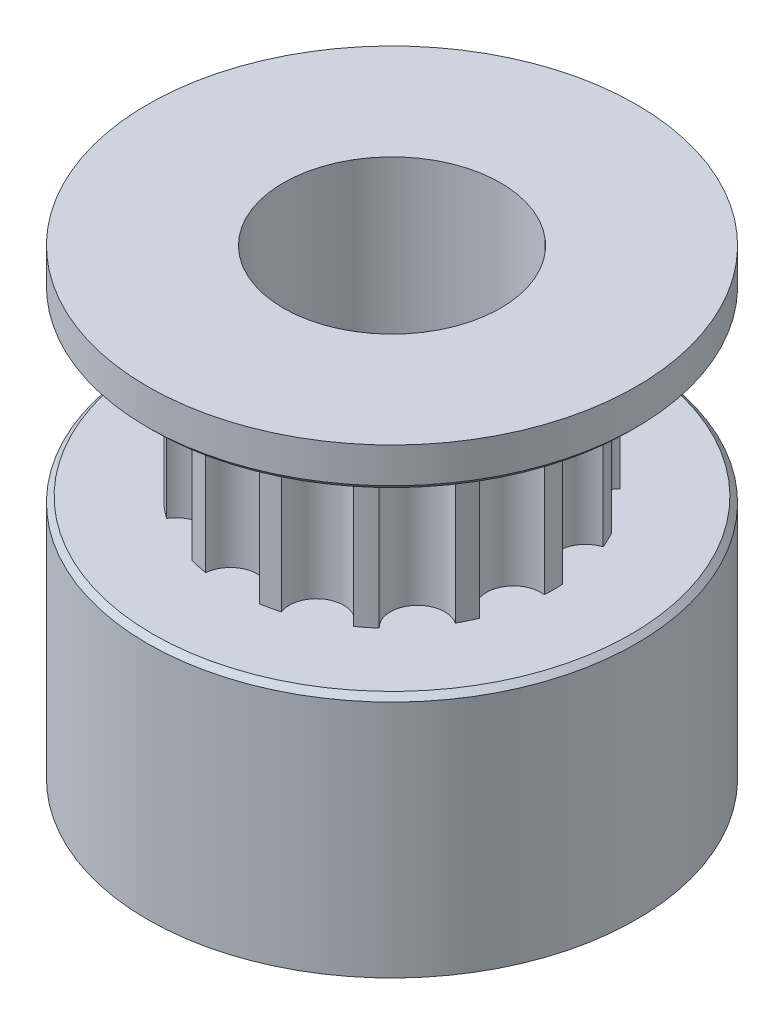
from build123d import *

# Parameters (mm, degrees)
SKETCH_2_R          = 9
EXTRUDE_1_DEPTH     = 9
EXTRUDE_2_DEPTH     = 6.5
SKETCH_4_R          = 9
EXTRUDE_3_DEPTH     = 1.5
SKETCH_5_R          = 4
CUT_EXTRUDE_1_DEPTH = 22.236760582
CHAMFER_1_SIZE      = 0.2


with BuildPart() as part:
    # 草图2 → 凸台-拉伸1 (new body)
    with BuildSketch(Plane(origin=(0, 0, 0), x_dir=(1, 0, 0), z_dir=(0, 1, 0))):
        with Locations(Location((0, 0, 0), (0, 0, 270))):
            Circle(SKETCH_2_R)
    extrude(amount=EXTRUDE_1_DEPTH)

    # 草图3 → 凸台-拉伸2 (add)
    with BuildSketch(Plane(origin=(0, 9, 0), x_dir=(1, 0, 0), z_dir=(0, 1, 0))):
        with BuildLine():
            ThreePointArc((-3.444184526, 4.855302323), (-3.711538364, 4.654121901), (-3.967166599, 4.438238037))
            ThreePointArc((-3.967166599, 4.438238037), (-3.872290418, 3.088048563), (-5.20973976, 2.880100577))
            ThreePointArc((-5.20973976, 2.880100577), (-5.363328331, 2.582842797), (-5.499972914, 2.277425222))
            ThreePointArc((-5.499972914, 2.277425222), (-4.828667171, 1.102111772), (-5.943442141, 0.334459589))
            ThreePointArc((-5.943442141, 0.334459589), (-5.952845345, 0), (-5.943442141, -0.334459589))
            ThreePointArc((-5.943442141, -0.334459589), (-4.828667171, -1.102111772), (-5.499972914, -2.277425222))
            ThreePointArc((-5.499972914, -2.277425222), (-5.363328331, -2.582842797), (-5.20973976, -2.880100577))
            ThreePointArc((-5.20973976, -2.880100577), (-3.872290418, -3.088048563), (-3.967166599, -4.438238037))
            ThreePointArc((-3.967166599, -4.438238037), (-3.711538364, -4.654121901), (-3.444184526, -4.855302323))
            ThreePointArc((-3.444184526, -4.855302323), (-2.148959057, -4.462359463), (-1.648614285, -5.720003377))
            ThreePointArc((-1.648614285, -5.720003377), (-1.324632706, -5.803595083), (-0.996466307, -5.868851898))
            ThreePointArc((-0.996466307, -5.868851898), (0, -4.952845345), (0.996466307, -5.868851898))
            ThreePointArc((0.996466307, -5.868851898), (1.324632706, -5.803595083), (1.648614285, -5.720003377))
            ThreePointArc((1.648614285, -5.720003377), (2.148959057, -4.462359463), (3.444184526, -4.855302323))
            ThreePointArc((3.444184526, -4.855302323), (3.711538364, -4.654121901), (3.967166599, -4.438238037))
            ThreePointArc((3.967166599, -4.438238037), (3.872290418, -3.088048563), (5.20973976, -2.880100577))
            ThreePointArc((5.20973976, -2.880100577), (5.363328331, -2.582842797), (5.499972914, -2.277425222))
            ThreePointArc((5.499972914, -2.277425222), (4.828667171, -1.102111772), (5.943442141, -0.334459589))
            ThreePointArc((5.943442141, -0.334459589), (5.952845345, 0), (5.943442141, 0.334459589))
            ThreePointArc((5.943442141, 0.334459589), (4.828667171, 1.102111772), (5.499972914, 2.277425222))
            ThreePointArc((5.499972914, 2.277425222), (5.363328331, 2.582842797), (5.20973976, 2.880100577))
            ThreePointArc((5.20973976, 2.880100577), (3.872290418, 3.088048563), (3.967166599, 4.438238037))
            ThreePointArc((3.967166599, 4.438238037), (3.711538364, 4.654121901), (3.444184526, 4.855302323))
            ThreePointArc((3.444184526, 4.855302323), (2.148959057, 4.462359463), (1.648614285, 5.720003377))
            ThreePointArc((1.648614285, 5.720003377), (1.324632706, 5.803595083), (0.996466307, 5.868851898))
            ThreePointArc((0.996466307, 5.868851898), (0, 4.952845345), (-0.996466307, 5.868851898))
            ThreePointArc((-0.996466307, 5.868851898), (-1.324632706, 5.803595083), (-1.648614285, 5.720003377))
            ThreePointArc((-1.648614285, 5.720003377), (-2.148959057, 4.462359463), (-3.444184526, 4.855302323))
        make_face()
    extrude(amount=EXTRUDE_2_DEPTH)

    # 草图4 → 凸台-拉伸3 (add)
    with BuildSketch(Plane(origin=(0, 15.5, 0), x_dir=(1, 0, 0), z_dir=(0, 1, 0))):
        with Locations(Location((0, 0, 0), (0, 0, 270))):
            Circle(SKETCH_4_R)
    extrude(amount=EXTRUDE_3_DEPTH)

    # 草图5 → 切除-拉伸1 (cut, through all)
    with BuildSketch(Plane(origin=(0, 17, 0), x_dir=(1, 0, 0), z_dir=(0, 1, 0))):
        with Locations(Location((0, 0, 0), (0, 0, 270))):
            Circle(SKETCH_5_R)
    extrude(amount=-CUT_EXTRUDE_1_DEPTH, mode=Mode.SUBTRACT)

    # 倒角1
    chamfer_1_edges = [part.edges().sort_by_distance(p)[0] for p in [
        (0, 9, -9),
        (0, 15.5, -9),
    ]]
    chamfer(chamfer_1_edges, length=CHAMFER_1_SIZE)


solid = part.part
